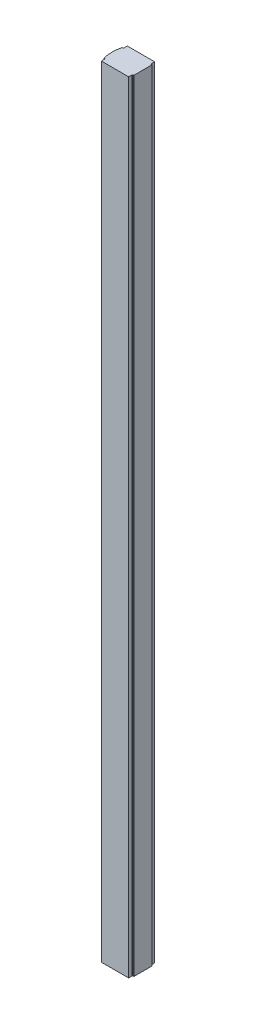
from build123d import *

# Parameters (mm, degrees)
SALIENTE_EXTRUIR1_DEPTH = 600


with BuildPart() as part:
    # Croquis1 → Saliente-Extruir1 (new body)
    with BuildSketch(Plane(origin=(0, 0, 0), x_dir=(1, 0, 0), z_dir=(0, 1, 0))):
        with BuildLine():
            Line((0, 2.5), (0, 0))
            Line((0, 0), (10.5, 0))
            Line((10.5, 0), (10.5, 20))
            Line((10.5, 20), (0, 20))
            Line((0, 20), (0, 17.5))
            ThreePointArc((0, 17.5), (-0.146446609, 17.146446609), (-0.5, 17))
            Line((-0.5, 17), (-1, 17))
            ThreePointArc((-1, 17), (-1.828095708, 10), (-1, 3))
            Line((-1, 3), (-0.5, 3))
            ThreePointArc((-0.5, 3), (-0.146446609, 2.853553391), (0, 2.5))
        make_face()
        with BuildLine():
            Line((10.5, 20), (10.5, 0))
            Line((10.5, 0), (21, 0))
            Line((21, 0), (21, 2.5))
            ThreePointArc((21, 2.5), (21.146446609, 2.853553391), (21.5, 3))
            Line((21.5, 3), (22, 3))
            Line((22, 3), (22, 17))
            Line((22, 17), (21.5, 17))
            ThreePointArc((21.5, 17), (21.146446609, 17.146446609), (21, 17.5))
            Line((21, 17.5), (21, 20))
            Line((21, 20), (10.5, 20))
        make_face()
    extrude(amount=SALIENTE_EXTRUIR1_DEPTH)


solid = part.part
